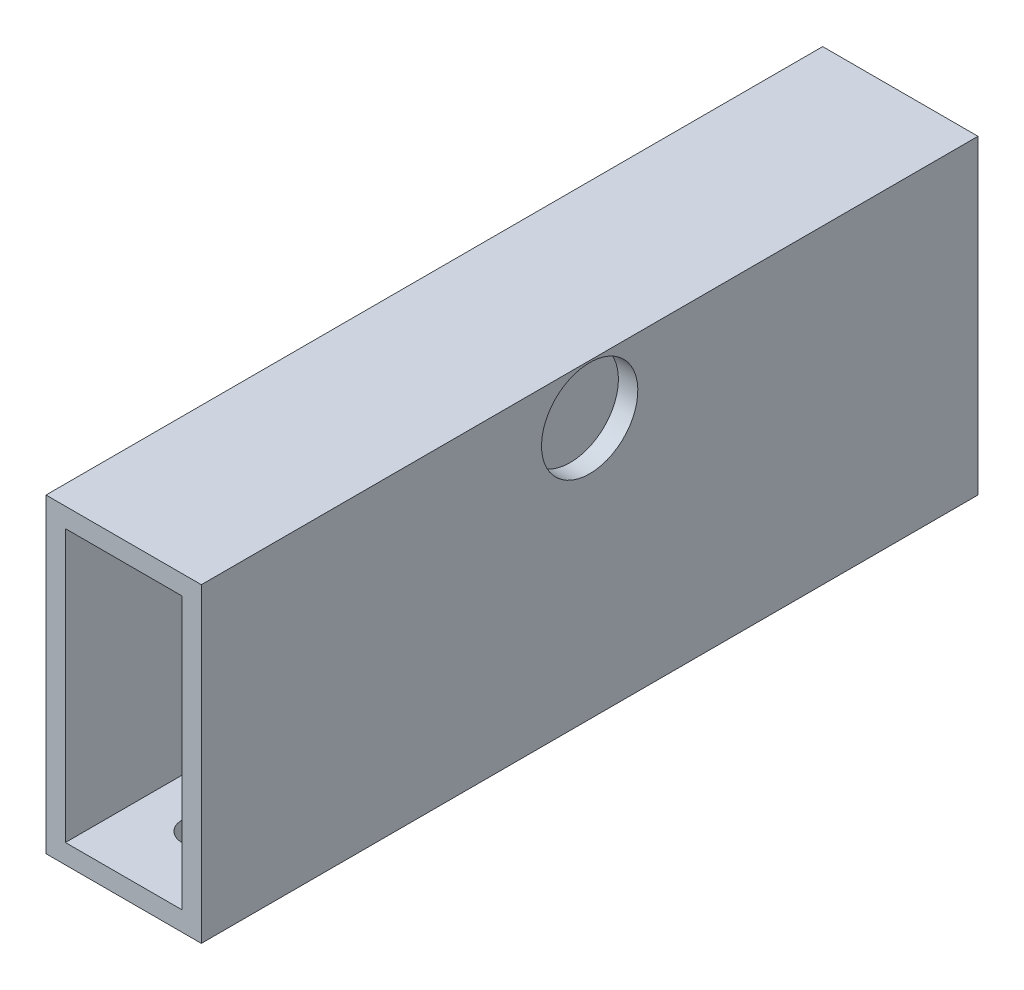
from build123d import *

# Parameters (mm, degrees)
SKETCH1_W           = 25.4
SKETCH1_H           = 50.8
SKETCH1_W_2         = 19.05
SKETCH1_H_2         = 44.45
BOSS_EXTRUDE1_DEPTH = 63.5
SKETCH2_R           = 7.874
CUT_EXTRUDE1_DEPTH  = 25.4
SKETCH3_R           = 3.175
CUT_EXTRUDE2_DEPTH  = 3.175


with BuildPart() as part:
    # Sketch1 → Boss-Extrude1 (new, symmetric)
    with BuildSketch(Plane.XY):
        with Locations((0.582385658, -5.091775964)):
            Rectangle(SKETCH1_W, SKETCH1_H)
        with Locations((0.582385658, -5.091775964)):
            Rectangle(SKETCH1_W_2, SKETCH1_H_2, mode=Mode.SUBTRACT)
    extrude(amount=BOSS_EXTRUDE1_DEPTH, both=True)

    # Sketch2 → Cut-Extrude1 (cut)
    with BuildSketch(Plane.ZY.offset(12.117614342)):
        with Locations(Location((0, 12.138059528, 0), (0, 0, 270))):
            Circle(SKETCH2_R)
    extrude(amount=-CUT_EXTRUDE1_DEPTH, mode=Mode.SUBTRACT)

    # Sketch3 → Cut-Extrude2 (cut)
    with BuildSketch(Plane.XZ.offset(30.491775964)):
        with Locations(Location((0.582385658, 50.8, 0), (0, 0, 270))):
            Circle(SKETCH3_R)
        with Locations(Location((0.582385658, -50.8, 0), (0, 0, 270))):
            Circle(SKETCH3_R)
    extrude(amount=-CUT_EXTRUDE2_DEPTH, mode=Mode.SUBTRACT)


solid = part.part
